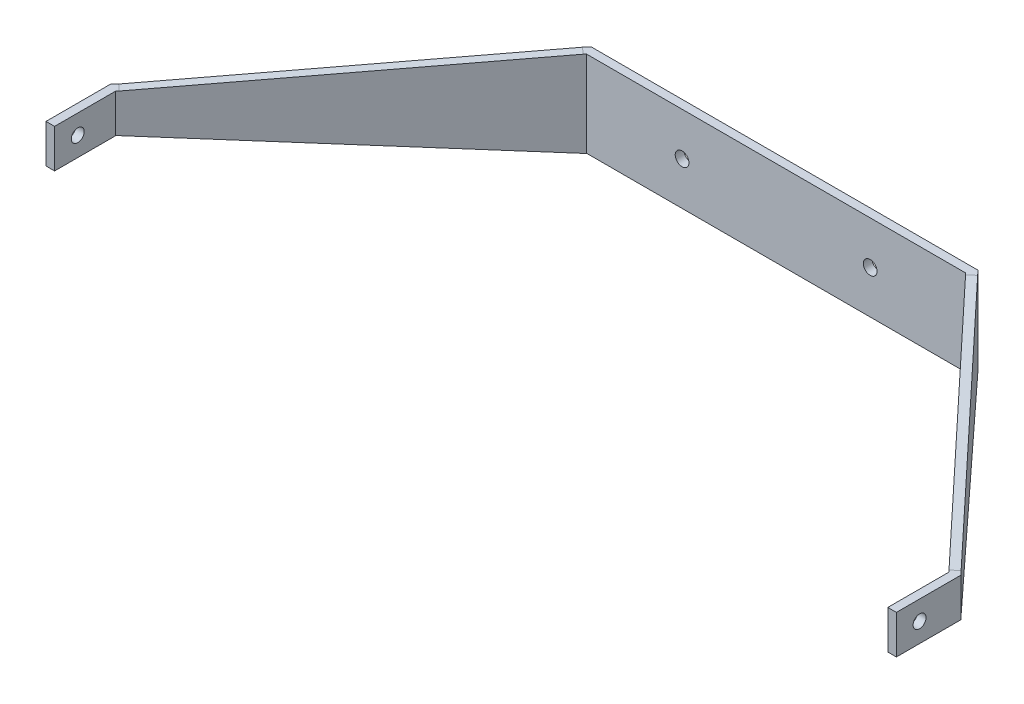
from build123d import *

# Parameters (mm, degrees)
SKETCH_1_W          = 2
SKETCH_1_H          = 15
EXTRUDE_1_DEPTH     = 9
EXTRUDE_1_2_DEPTH   = 9
SKETCH_2_R          = 1.5
CUT_EXTRUDE_1_DEPTH = 212.220264179
SKETCH_3_W          = 90
SKETCH_3_H          = 20
EXTRUDE_2_DEPTH     = 2
EXTRUDE_3_DEPTH     = 2
SKETCH_6_R          = 1.6
CUT_EXTRUDE_2_DEPTH = 10


with BuildPart() as part:
    # 草图1 → 凸台-拉伸1 (new body)
    with BuildSketch(Plane(origin=(0, 0, 0), x_dir=(1, 0, 0), z_dir=(0, 1, 0))):
        with Locations((1, -65.5)):
            Rectangle(SKETCH_1_W, SKETCH_1_H)
    extrude(amount=EXTRUDE_1_DEPTH)


with BuildPart() as body_2:
    # 草图1 → Extrude 1 2 (new body)
    with BuildSketch(Plane(origin=(0, 0, 0), x_dir=(1, 0, 0), z_dir=(0, 1, 0))):
        with Locations((197, -65.5)):
            Rectangle(SKETCH_1_W, SKETCH_1_H)
    extrude(amount=EXTRUDE_1_2_DEPTH)


with BuildPart() as cut_extrude_1_tool:
    # 草图2 → 切除-拉伸1 (new, through all)
    with BuildSketch(Plane(origin=(198, 0, 0), x_dir=(0, 0, -1), z_dir=(1, 0, 0))):
        with Locations((-67.601305665, 4.5)):
            Circle(SKETCH_2_R)
    extrude(amount=-CUT_EXTRUDE_1_DEPTH)


with BuildPart() as part_1:
    add(part.part)

    # 切除-拉伸1: cut by cut_extrude_1_tool
    add(cut_extrude_1_tool.part, mode=Mode.SUBTRACT)


with BuildPart() as body_2_1:
    add(body_2.part)

    # 切除-拉伸1: cut by cut_extrude_1_tool
    add(cut_extrude_1_tool.part, mode=Mode.SUBTRACT)



with BuildPart() as body_3:
    # 草图3 → 凸台-拉伸2 (new body)
    with BuildSketch(Plane.XY):
        with Locations((99, 4.5)):
            Rectangle(SKETCH_3_W, SKETCH_3_H)
    extrude(amount=EXTRUDE_2_DEPTH)


with BuildPart() as body_2_2:
    add(body_2_1.part)

    add(body_3.part)  # 凸台-拉伸3 merges body 3
    # 草图4 → 凸台-拉伸3 (add)
    with BuildSketch(Plane(origin=(77.136305732, 0, -71.81656051), x_dir=(-0.6814185279188432, 0, -0.7318939744313494), z_dir=(0.7318939744313494, 0, -0.6814185279188432))):
        Polygon((-176.007881989, 9), (-177.370719045, 9), (-177.370719045, 0), (-176.007881989, 0), (-99.588055969, -5.5), (-98.12426802, -5.5), (-98.12426802, 14.5), (-99.588055969, 14.5), align=None)
    extrude_3 = extrude(amount=-EXTRUDE_3_DEPTH)

    # 镜向1: 凸台-拉伸3 across plane
    add(extrude_3.mirror(Plane(origin=(99, 0, 0), x_dir=(0, 0, 1), z_dir=(1, 0, 0))))

    # Combine 1: union part
    add(part_1.part)

    # 草图6 → 切除-拉伸2 (cut)
    with BuildSketch(Plane(origin=(0, 0, 0), x_dir=(-1, 0, 0), z_dir=(0, 0, -1))):
        with Locations((-120.9, 4.5)):
            Circle(SKETCH_6_R)
        with Locations((-77.1, 4.5)):
            Circle(SKETCH_6_R)
    extrude(amount=-CUT_EXTRUDE_2_DEPTH, mode=Mode.SUBTRACT)


solid = body_2_2.part
